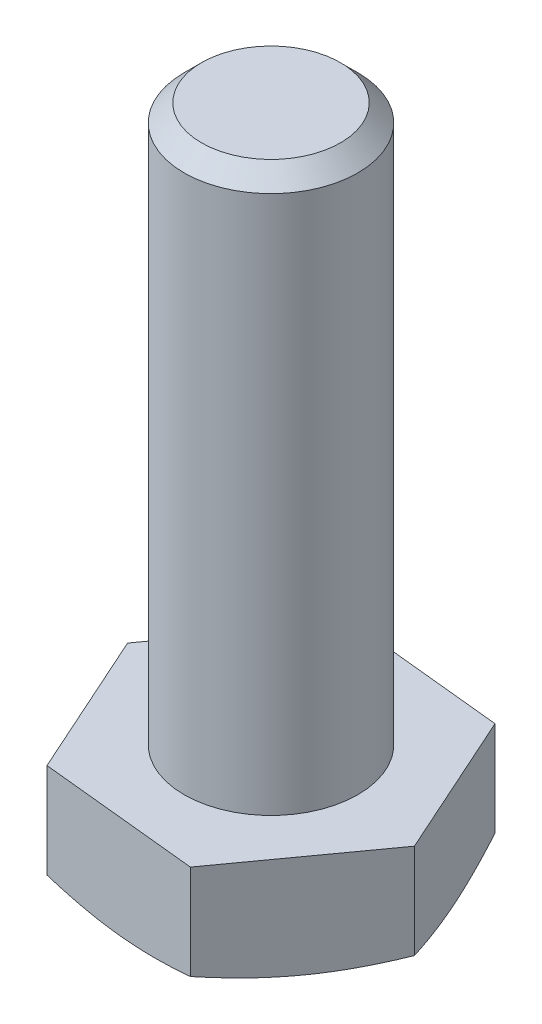
from build123d import *

# Parameters (mm, degrees)
SKETCH1_R           = 2.5
BOSS_EXTRUDE1_DEPTH = 16
CHAMFER1_SIZE       = 0.5
BOSS_EXTRUDE2_DEPTH = 3.5


with BuildPart() as part:
    # Sketch1 → Boss-Extrude1 (new body)
    with BuildSketch(Plane(origin=(0, 0, 0), x_dir=(1, 0, 0), z_dir=(0, 1, 0))):
        with Locations(Location((0, 0, 0), (0, 0, 270))):
            Circle(SKETCH1_R)
    extrude(amount=BOSS_EXTRUDE1_DEPTH)

    # Chamfer1
    chamfer1_edges = [part.edges().sort_by_distance(p)[0] for p in [
        (0, 16, -2.5),
    ]]
    chamfer(chamfer1_edges, length=CHAMFER1_SIZE)

    # Sketch2 → Boss-Extrude2 (add)
    with BuildSketch(Plane.XZ):
        Polygon((4.595076966, 0.467547866), (1.892630154, 4.213227318), (-2.702446812, 3.745679452), (-4.595076966, -0.467547866), (-1.892630154, -4.213227318), (2.702446812, -3.745679452), align=None)
    extrude(amount=BOSS_EXTRUDE2_DEPTH)

    # Sketch4 → Cut-Revolve1 (revolve, cut)
    with BuildSketch(Plane(origin=(0, 0, 0), x_dir=(0, 0, -1), z_dir=(1, 0, 0))):
        Polygon((0, -3.5), (2.5, -3.5), (6.193754438, -2.155583332), (6.193754438, -4.64679672), (0, -4.64679672), align=None)
    revolve(axis=Axis((0, 0, 0), (0, -1, 0)), mode=Mode.SUBTRACT)


solid = part.part
